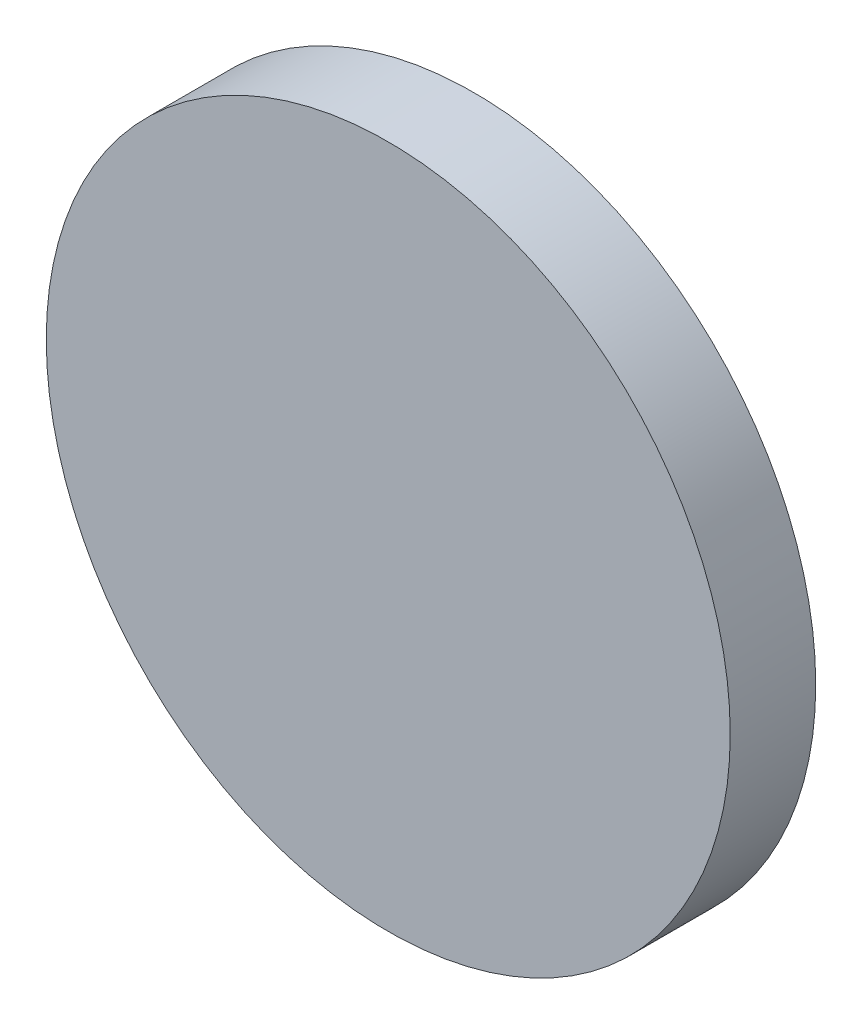
from build123d import *

# Parameters (mm, degrees)
SKETCH1_R           = 12.7
BOSS_EXTRUDE1_DEPTH = 3.175


with BuildPart() as part:
    # Sketch1 → Boss-Extrude1 (new body)
    with BuildSketch(Plane.XY):
        Circle(SKETCH1_R)
    extrude(amount=BOSS_EXTRUDE1_DEPTH)


solid = part.part
